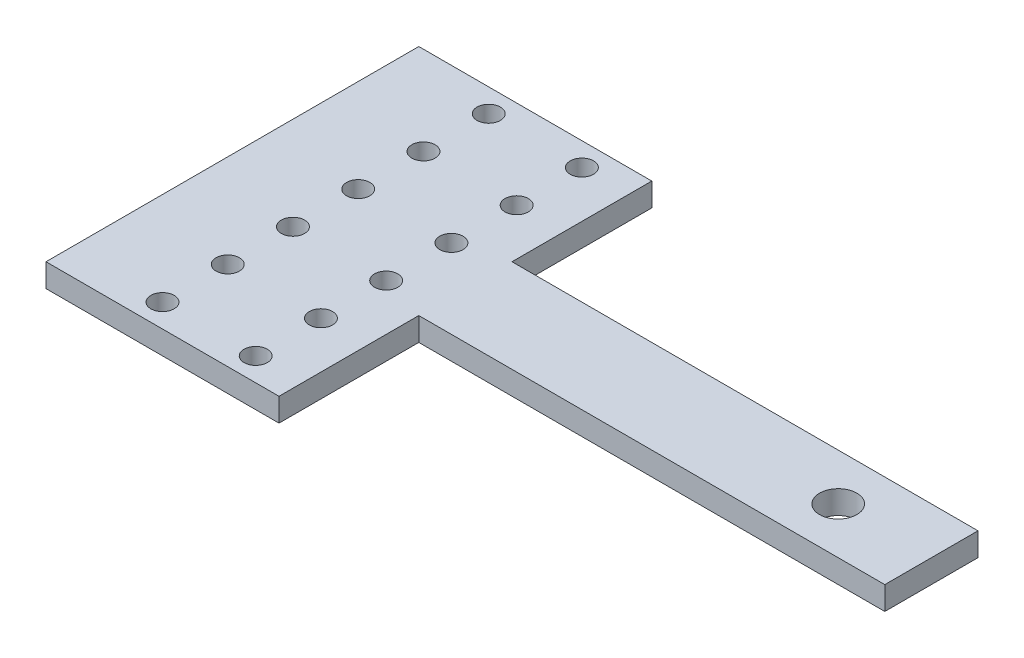
from build123d import *

# Parameters (mm, degrees)
EXTRUDE_1_DEPTH     = 2.5
SKETCH_2_R          = 1.25
CUT_EXTRUDE_1_DEPTH = 78.661122835
SKETCH_3_R          = 2
CUT_EXTRUDE_2_DEPTH = 10


with BuildPart() as part:
    # 草图1 → 凸台-拉伸1 (new body)
    with BuildSketch(Plane(origin=(0, 0, 0), x_dir=(1, 0, 0), z_dir=(0, 1, 0))):
        Polygon((0, -20), (0, 20), (25, 20), (25, 5), (75, 5), (75, -5), (25, -5), (25, -20), align=None)
    extrude(amount=EXTRUDE_1_DEPTH)

    # 草图2 → 切除-拉伸1 (cut, through all)
    with BuildSketch(Plane(origin=(0, 0, 0), x_dir=(1, 0, 0), z_dir=(0, 1, 0))):
        with Locations(Location((10, 17.5, 0), (0, 0, 270))):
            Circle(SKETCH_2_R)
        with Locations(Location((20, 17.5, 0), (0, 0, 270))):
            Circle(SKETCH_2_R)
        with Locations(Location((20, 10.5, 0), (0, 0, 270))):
            Circle(SKETCH_2_R)
        with Locations(Location((20, 3.5, 0), (0, 0, 270))):
            Circle(SKETCH_2_R)
        with Locations(Location((20, -3.5, 0), (0, 0, 270))):
            Circle(SKETCH_2_R)
        with Locations(Location((20, -10.5, 0), (0, 0, 270))):
            Circle(SKETCH_2_R)
        with Locations(Location((20, -17.5, 0), (0, 0, 270))):
            Circle(SKETCH_2_R)
        with Locations(Location((10, 10.5, 0), (0, 0, 270))):
            Circle(SKETCH_2_R)
        with Locations(Location((10, 3.5, 0), (0, 0, 270))):
            Circle(SKETCH_2_R)
        with Locations(Location((10, -3.5, 0), (0, 0, 270))):
            Circle(SKETCH_2_R)
        with Locations(Location((10, -10.5, 0), (0, 0, 270))):
            Circle(SKETCH_2_R)
        with Locations(Location((10, -17.5, 0), (0, 0, 270))):
            Circle(SKETCH_2_R)
    extrude(amount=CUT_EXTRUDE_1_DEPTH, mode=Mode.SUBTRACT)

    # 草图3 → 切除-拉伸2 (cut)
    with BuildSketch(Plane(origin=(0, 0, 0), x_dir=(1, 0, 0), z_dir=(0, 1, 0))):
        with Locations(Location((65, 0, 0), (0, 0, 270))):
            Circle(SKETCH_3_R)
    extrude(amount=CUT_EXTRUDE_2_DEPTH, mode=Mode.SUBTRACT)


solid = part.part
